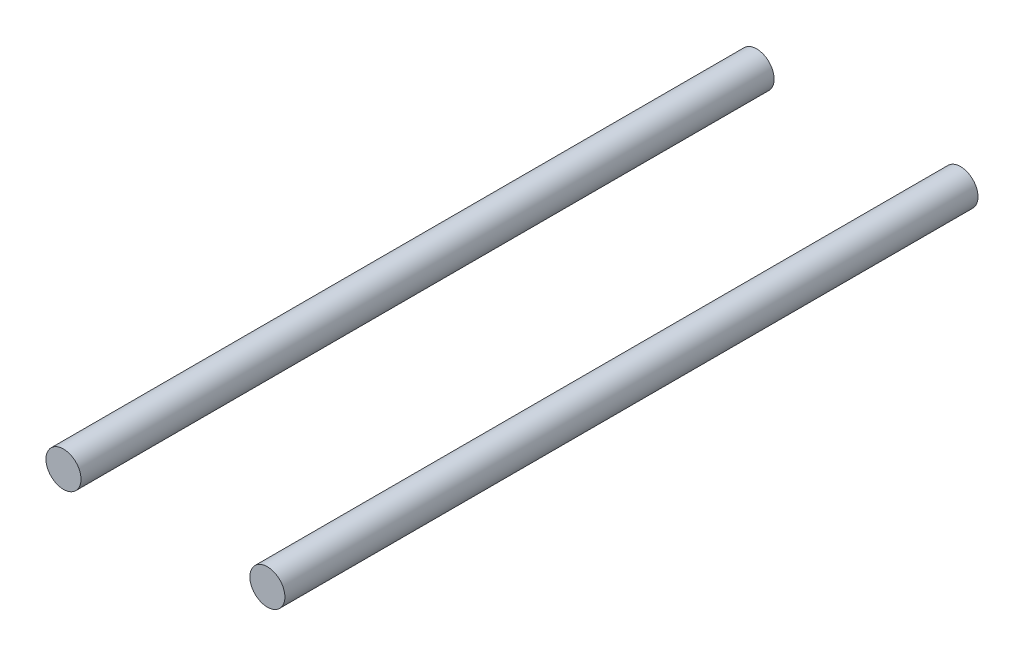
from build123d import *

# Parameters (mm, degrees)
SKETCH1_R             = 5.135
BOSS_EXTRUDE1_DEPTH   = 203.2
BOSS_EXTRUDE1_2_DEPTH = 203.2


with BuildPart() as part:
    # Sketch1 → Boss-Extrude1 (new body)
    with BuildSketch(Plane.XY):
        with Locations((-29.885, 0)):
            Circle(SKETCH1_R)
    extrude(amount=BOSS_EXTRUDE1_DEPTH)


with BuildPart() as body_2:
    # Sketch1 → Boss-Extrude1 2 (new body)
    with BuildSketch(Plane.XY):
        with Locations((29.885, 0)):
            Circle(SKETCH1_R)
    extrude(amount=BOSS_EXTRUDE1_2_DEPTH)


solid = Compound([part.part, body_2.part])
